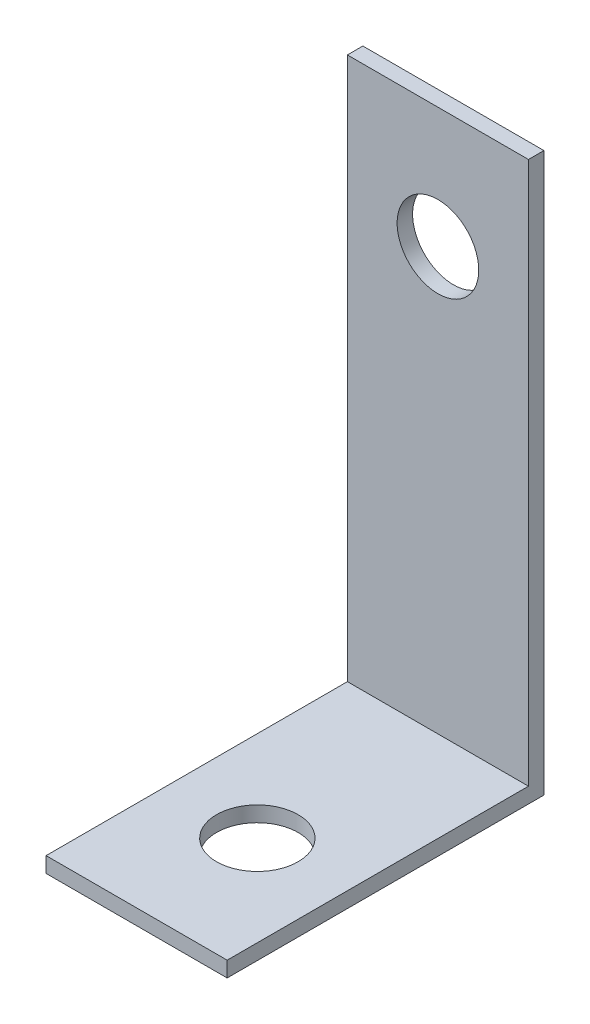
from build123d import *

# Parameters (mm, degrees)
SKETCH1_W           = 9.525
SKETCH1_H           = 16.6624
BOSS_EXTRUDE1_DEPTH = 0.8128
SKETCH2_W           = 9.525
SKETCH2_H           = 0.8128
BOSS_EXTRUDE2_DEPTH = 28.5496
SKETCH3_R           = 2.1463
CUT_EXTRUDE1_DEPTH  = 35.401175255
SKETCH4_R           = 2.1463
CUT_EXTRUDE2_DEPTH  = 35.699942059


with BuildPart() as part:
    # Sketch1 → Boss-Extrude1 (new body)
    with BuildSketch(Plane(origin=(0, 0, 0), x_dir=(1, 0, 0), z_dir=(0, 1, 0))):
        with Locations((4.7625, 8.3312)):
            Rectangle(SKETCH1_W, SKETCH1_H)
    extrude(amount=BOSS_EXTRUDE1_DEPTH)

    # Sketch2 → Boss-Extrude2 (add)
    with BuildSketch(Plane(origin=(0, 0.8128, 0), x_dir=(1, 0, 0), z_dir=(0, 1, 0))):
        with Locations((4.7625, 16.256)):
            Rectangle(SKETCH2_W, SKETCH2_H)
    extrude(amount=BOSS_EXTRUDE2_DEPTH)

    # Sketch3 → Cut-Extrude1 (cut, through all)
    with BuildSketch(Plane(origin=(0, 0.8128, 0), x_dir=(1, 0, 0), z_dir=(0, 1, 0))):
        with Locations(Location((4.7625, 6.35, 0), (0, 0, 270))):
            Circle(SKETCH3_R)
    extrude(amount=-CUT_EXTRUDE1_DEPTH, mode=Mode.SUBTRACT)

    # Sketch4 → Cut-Extrude2 (cut, through all)
    with BuildSketch(Plane.XY.offset(-15.8496)):
        with Locations((4.7625, 23.0124)):
            Circle(SKETCH4_R)
    extrude(amount=-CUT_EXTRUDE2_DEPTH, mode=Mode.SUBTRACT)


solid = part.part
